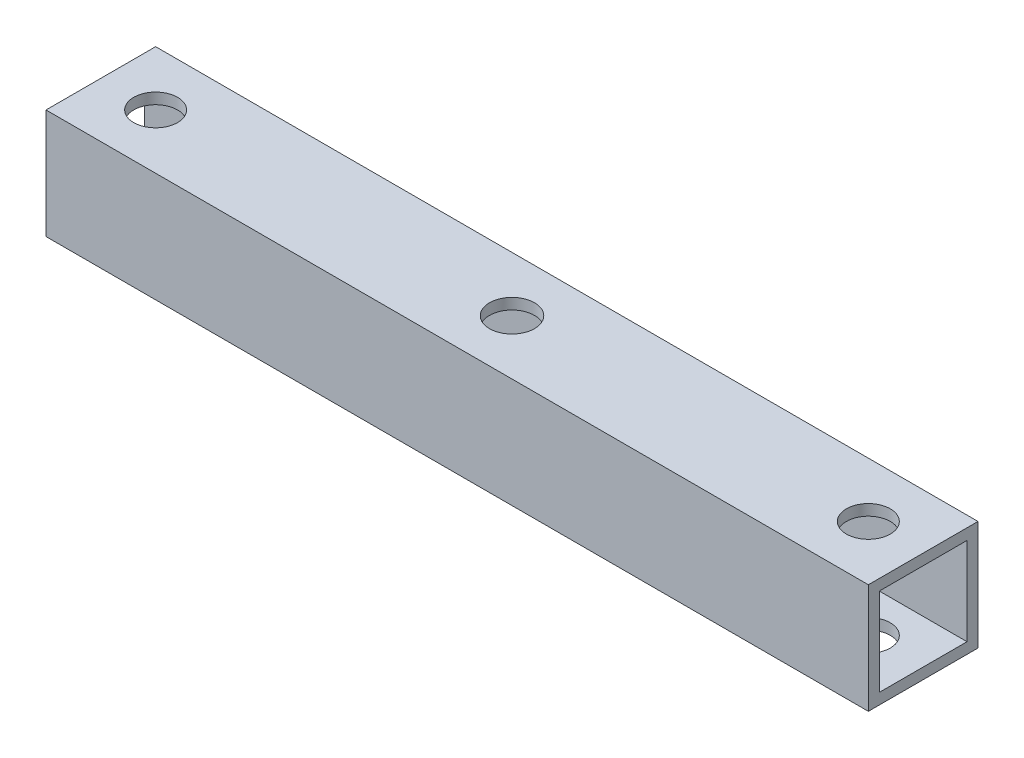
from build123d import *

# Parameters (mm, degrees)
SKETCH1_W           = 20
SKETCH1_H           = 20
SKETCH1_W_2         = 16
SKETCH1_H_2         = 16
BOSS_EXTRUDE1_DEPTH = 150
SKETCH2_R           = 4
CUT_EXTRUDE1_DEPTH  = 152.657508881
SKETCH3_R           = 4.1
CUT_EXTRUDE2_DEPTH  = 152.657508881


with BuildPart() as part:
    # Sketch1 → Boss-Extrude1 (new body)
    with BuildSketch(Plane(origin=(0, 0, 0), x_dir=(0, 0, -1), z_dir=(1, 0, 0))):
        Rectangle(SKETCH1_W, SKETCH1_H)
        Rectangle(SKETCH1_W_2, SKETCH1_H_2, mode=Mode.SUBTRACT)
    extrude(amount=BOSS_EXTRUDE1_DEPTH)

    # Sketch2 → Cut-Extrude1 (cut, through all)
    with BuildSketch(Plane(origin=(0, 10, 0), x_dir=(1, 0, 0), z_dir=(0, 1, 0))):
        with Locations(Location((10, 0, 0), (0, 0, 270))):
            Circle(SKETCH2_R)
        with Locations(Location((140, 0, 0), (0, 0, 270))):
            Circle(SKETCH2_R)
    extrude(amount=-CUT_EXTRUDE1_DEPTH, mode=Mode.SUBTRACT)

    # Sketch3 → Cut-Extrude2 (cut, through all)
    with BuildSketch(Plane(origin=(0, 10, 0), x_dir=(1, 0, 0), z_dir=(0, 1, 0))):
        with Locations(Location((75, 0, 0), (0, 0, 270))):
            Circle(SKETCH3_R)
    extrude(amount=-CUT_EXTRUDE2_DEPTH, mode=Mode.SUBTRACT)


solid = part.part
